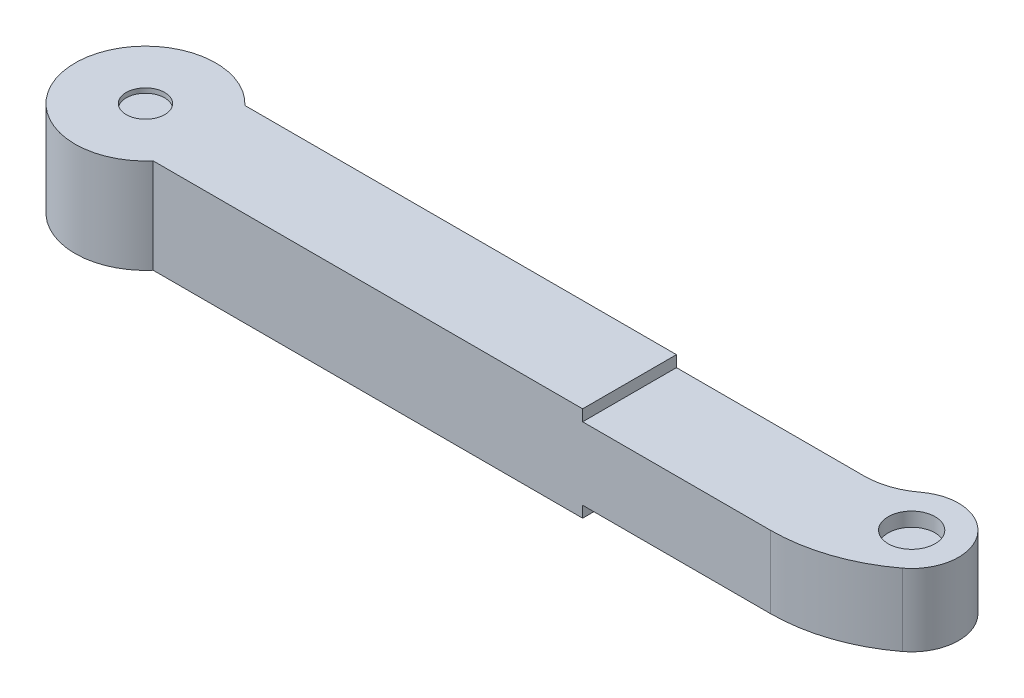
from build123d import *

# Parameters (mm, degrees)
SALIENTE_EXTRUIR1_DEPTH = 10.1
CROQUIS7_R              = 2.05
CORTAR_EXTRUIR1_DEPTH   = 0.5
CROQUIS11_W             = 20
CROQUIS11_H             = 1.2
CORTAR_EXTRUIR4_DEPTH   = 49.726011614
SALIENTE_EXTRUIR2_START = -7.7
SALIENTE_EXTRUIR2_DEPTH = 7.7
CROQUIS15_R             = 2.5
CORTAR_EXTRUIR5_DEPTH   = 1.5


with BuildPart() as part:
    # Croquis1 → Saliente-Extruir1 (new body)
    with BuildSketch(Plane(origin=(0, 0, 0), x_dir=(1, 0, 0), z_dir=(0, 1, 0))):
        with BuildLine():
            Line((-32.835114186, -4.991653889), (32.944915669, -4.991653889))
            Line((32.944915669, -4.991653889), (32.944915669, 5.008346111))
            Line((32.944915669, 5.008346111), (-33.055084331, 5.008346111))
            ThreePointArc((-33.055084331, 5.008346111), (-46.031021583, -0.279505113), (-32.835114186, -4.991653889))
        make_face()
    extrude(amount=SALIENTE_EXTRUIR1_DEPTH)

    # Croquis7 → Cortar-Extruir1 (cut)
    with BuildSketch(Plane(origin=(0, 10.1, 0), x_dir=(1, 0, 0), z_dir=(0, 1, 0))):
        with Locations(Location((-38.532835433, -0.114567403, 0), (0, 0, 270))):
            Circle(CROQUIS7_R)
    extrude(amount=-CORTAR_EXTRUIR1_DEPTH, mode=Mode.SUBTRACT)

    # Croquis11 → Cortar-Extruir4 (cut, through all)
    with BuildSketch(Plane.XY.offset(4.991653889)):
        with Locations((22.944915669, 9.5)):
            Rectangle(CROQUIS11_W, CROQUIS11_H)
        with Locations((22.944915669, 0.6)):
            Rectangle(CROQUIS11_W, CROQUIS11_H)
    extrude(amount=-CORTAR_EXTRUIR4_DEPTH, mode=Mode.SUBTRACT)

    # Croquis14 → Saliente-Extruir2 (add)
    with BuildSketch(Plane(origin=(0, 8.9, 0), x_dir=(1, 0, 0), z_dir=(0, 1, 0)).offset(SALIENTE_EXTRUIR2_START)):
        with BuildLine():
            Line((32.944915669, 5.008346111), (32.944915669, -4.991653889))
            ThreePointArc((32.944915669, -4.991653889), (38.512321796, -4.082434131), (43.501214134, -1.449252634))
            ThreePointArc((43.501214134, -1.449252634), (44.473014214, 5.554717998), (37.469043582, 6.526518077))
            ThreePointArc((37.469043582, 6.526518077), (35.330946866, 5.398011722), (32.944915669, 5.008346111))
        make_face()
    extrude(amount=SALIENTE_EXTRUIR2_DEPTH)

    # Croquis15 → Cortar-Extruir5 (cut)
    with BuildSketch(Plane(origin=(0, 8.9, 0), x_dir=(1, 0, 0), z_dir=(0, 1, 0))):
        with Locations(Location((40.485128858, 2.538632722, 0), (0, 0, 270))):
            Circle(CROQUIS15_R)
    cortar_extruir5 = extrude(amount=-CORTAR_EXTRUIR5_DEPTH, mode=Mode.SUBTRACT)

    # Simetría1: Cortar-Extruir5 across plane
    add(cortar_extruir5.mirror(Plane.ZX.offset(5.05)), mode=Mode.SUBTRACT)


solid = part.part
